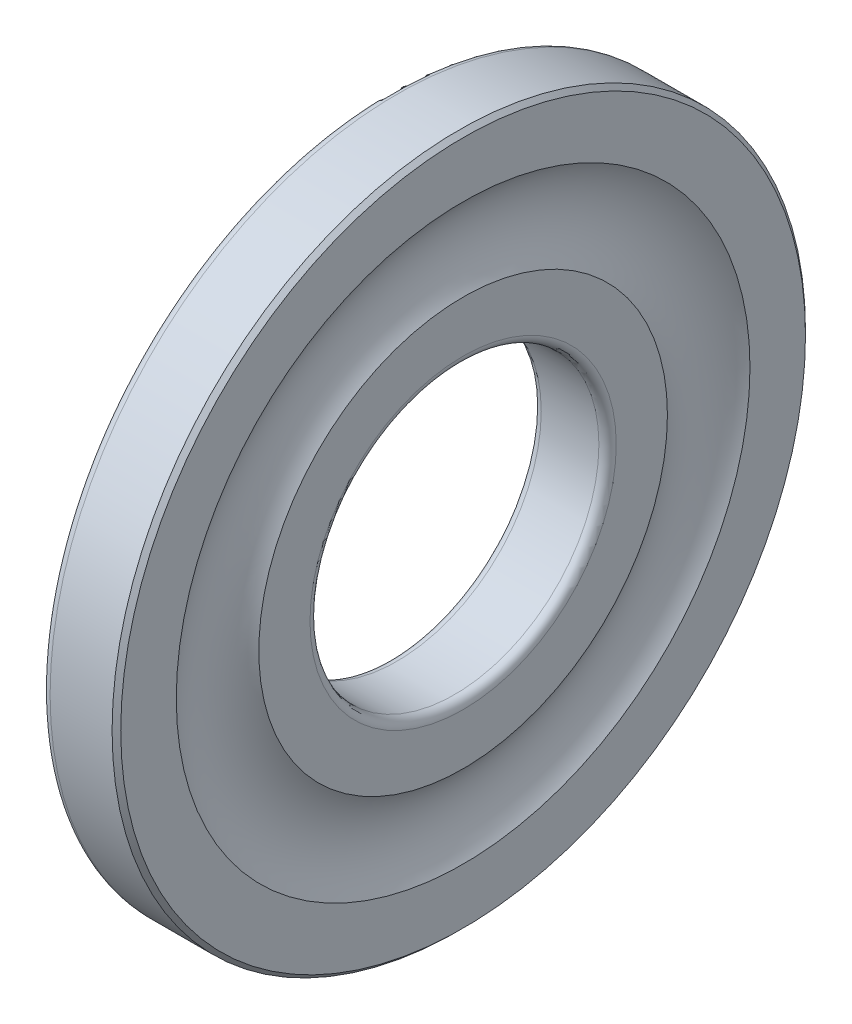
from build123d import *

# Parameters (mm, degrees)
CHAMFER_1_SIZE      = 0.15
CUT_EXTRUDE_1_DEPTH = 0.01


with BuildPart() as part:
    # Эскиз1 → Повернуть1 (revolve)
    with BuildSketch(Plane.XY, mode=Mode.PRIVATE) as revolve_1_sk:
        with BuildLine():
            Line((2.5952, 5.3), (2.5952, 7.0714))
            ThreePointArc((2.5952, 7.0714), (2.119, 8.5), (2.5952, 9.9286))
            Line((2.5952, 9.9286), (2.5952, 12))
            Line((2.5952, 12), (0.3, 12))
            ThreePointArc((0.3, 12), (0.087867966, 11.912132034), (0, 11.7))
            Line((0, 11.7), (0, 5.3))
            ThreePointArc((0, 5.3), (0.087867966, 5.087867966), (0.3, 5))
            Line((0.3, 5), (2.2952, 5))
            ThreePointArc((2.2952, 5), (2.507332034, 5.087867966), (2.5952, 5.3))
        make_face()
    revolve(revolve_1_sk.sketch.rotate(Axis((-0.001250003, 0, 0), (1, 0, 0)), 270), axis=Axis((-0.001250003, 0, 0), (1, 0, 0)))

    # Фаска1
    chamfer_1_edges = [part.edges().sort_by_distance(p)[0] for p in [
        (2.5952, 0, 12),
    ]]
    chamfer(chamfer_1_edges, length=CHAMFER_1_SIZE)

    # Эскиз2 → Вырез-Вытянуть1 (cut)
    # profile 1 of 5: a face of its own
    with BuildSketch(Plane.ZY):
        with BuildLine():
            Line((-3.449335757, 9.698230497), (-3.235874219, 9.78224492))
            add(Edge.make_bspline(
                [(-3.235874219, 9.78224492), (-3.229784564, 9.769899998), (-3.217947999, 9.745904967), (-3.197945585, 9.712169719), (-3.176818259, 9.681394817), (-3.153925474, 9.653956854), (-3.130212704, 9.629316466), (-3.105219723, 9.607763589), (-3.07871945, 9.589750729), (-3.051213621, 9.574509078), (-3.022855934, 9.562200995), (-2.9937566, 9.553314219), (-2.964495071, 9.546645666), (-2.934775992, 9.543065191), (-2.904706945, 9.54232803), (-2.874182548, 9.544603438), (-2.843241628, 9.549494129), (-2.822848423, 9.555124623), (-2.812556911, 9.557966074)],
                knots=[0, 0, 0, 0, 1.251147457, 2.431876173, 3.562593119, 4.641368937, 5.676936526, 6.669039123, 7.635965545, 8.584877578, 9.524748234, 10.440680684, 11.347440475, 12.250174455, 13.157460896, 14.077750772, 15.029929294, 16, 16, 16, 16], degree=3))
            add(Edge.make_bspline(
                [(-2.812556911, 9.557966074), (-2.800328284, 9.562057848), (-2.776262875, 9.570110282), (-2.742115967, 9.586101361), (-2.710665216, 9.605338147), (-2.681496713, 9.627399487), (-2.655084462, 9.652977753), (-2.630757878, 9.681401611), (-2.609563587, 9.713414591), (-2.59096418, 9.747960407), (-2.574846901, 9.78442881), (-2.563557595, 9.823031207), (-2.555299435, 9.862799408), (-2.552035869, 9.904053085), (-2.551931791, 9.946512303), (-2.555950461, 9.990340343), (-2.564357948, 10.035396113), (-2.572558752, 10.065470429), (-2.576739603, 10.080802612)],
                knots=[0, 0, 0, 0, 0.964056349, 1.8972211, 2.813161018, 3.717688707, 4.627029644, 5.558373415, 6.510957515, 7.492588551, 8.491363712, 9.486896088, 10.495497353, 11.524412324, 12.576364546, 13.668767218, 14.811514488, 16, 16, 16, 16], degree=3))
            add(Edge.make_bspline(
                [(-2.576739603, 10.080802612), (-2.581325243, 10.09518457), (-2.590313804, 10.123375422), (-2.607236459, 10.163350928), (-2.626752282, 10.200070326), (-2.648864893, 10.233284222), (-2.672920973, 10.263551198), (-2.700038176, 10.289982323), (-2.729131525, 10.31369327), (-2.761022358, 10.333225171), (-2.794054771, 10.35001214), (-2.828542498, 10.362712545), (-2.864020008, 10.371303463), (-2.900369542, 10.376349782), (-2.93772467, 10.378004484), (-2.976096574, 10.374727498), (-3.015467071, 10.368422984), (-3.041577301, 10.361333483), (-3.054864603, 10.357725689)],
                knots=[0, 0, 0, 0, 1.16139328, 2.276509754, 3.336018836, 4.357193876, 5.343973991, 6.305585848, 7.266351863, 8.22636044, 9.17790747, 10.114497127, 11.047883193, 11.982002477, 12.935570972, 13.918962916, 14.940975672, 16, 16, 16, 16], degree=3))
            add(Edge.make_bspline(
                [(-3.054864603, 10.357725689), (-3.071148653, 10.352399172), (-3.103242876, 10.341901142), (-3.14765354, 10.318735913), (-3.188243725, 10.291182545), (-3.22411817, 10.258776827), (-3.255079578, 10.222771602), (-3.280781584, 10.18419103), (-3.301993948, 10.143763942), (-3.311048164, 10.114982153), (-3.315561719, 10.100634343)],
                knots=[0, 0, 0, 0, 1.074591029, 2.117910793, 3.13352036, 4.149214105, 5.144959231, 6.108146363, 7.056905143, 8, 8, 8, 8], degree=3))
            Line((-3.315561719, 10.100634343), (-3.51928768, 10.067821843))
            Line((-3.51928768, 10.067821843), (-3.614840565, 10.990898766))
            Line((-3.614840565, 10.990898766), (-2.768927103, 11.242942036))
            Line((-2.768927103, 11.242942036), (-2.709431911, 11.043542997))
            Line((-2.709431911, 11.043542997), (-3.388398257, 10.841259343))
            Line((-3.388398257, 10.841259343), (-3.343686719, 10.356643959))
            add(Edge.make_bspline(
                [(-3.343686719, 10.356643959), (-3.333551588, 10.368965134), (-3.313529728, 10.393305504), (-3.280383896, 10.426203404), (-3.246728325, 10.456816943), (-3.210983525, 10.483619083), (-3.173979396, 10.507356238), (-3.135485273, 10.528140773), (-3.095538626, 10.545504232), (-3.067924786, 10.554458683), (-3.05414345, 10.558927612)],
                knots=[0, 0, 0, 0, 1.066534603, 2.10692949, 3.120478869, 4.107795162, 5.091339616, 6.058982001, 7.031289356, 8, 8, 8, 8], degree=3))
            add(Edge.make_bspline(
                [(-3.05414345, 10.558927612), (-3.035842725, 10.564012249), (-2.999723687, 10.574047489), (-2.944776913, 10.582024897), (-2.890579276, 10.585093968), (-2.837161753, 10.582580883), (-2.784493238, 10.574558686), (-2.732592799, 10.561214925), (-2.681585446, 10.541850592), (-2.631789008, 10.5173846), (-2.584020524, 10.488631048), (-2.54004337, 10.454696124), (-2.50011179, 10.416744387), (-2.463438571, 10.375121276), (-2.43198337, 10.328484827), (-2.403526369, 10.278290446), (-2.379790112, 10.223520913), (-2.367182044, 10.185117527), (-2.360754026, 10.165538189)],
                knots=[0, 0, 0, 0, 1.021464354, 2.016002635, 2.981327351, 3.939864647, 4.888659207, 5.844244694, 6.818739042, 7.819820684, 8.827257802, 9.814552537, 10.803033517, 11.78894957, 12.793849321, 13.824998917, 14.891111263, 16, 16, 16, 16], degree=3))
            add(Edge.make_bspline(
                [(-2.360754026, 10.165538189), (-2.355524039, 10.146500194), (-2.345183164, 10.108857745), (-2.335126865, 10.051911632), (-2.330191281, 9.995695659), (-2.329231994, 9.940225175), (-2.333491016, 9.885385296), (-2.343291891, 9.83135398), (-2.356464583, 9.777786204), (-2.369642974, 9.743305192), (-2.376258834, 9.72599492)],
                knots=[0, 0, 0, 0, 1.056062487, 2.088075833, 3.089019414, 4.073125904, 5.053758584, 6.02653515, 7.009274636, 8, 8, 8, 8], degree=3))
            add(Edge.make_bspline(
                [(-2.376258834, 9.72599492), (-2.385270404, 9.705319007), (-2.402955232, 9.664743396), (-2.43749097, 9.608700363), (-2.477229249, 9.557948428), (-2.522815104, 9.512358955), (-2.574138647, 9.472241083), (-2.631460633, 9.437944589), (-2.693956964, 9.408387549), (-2.738575533, 9.393786065), (-2.761354988, 9.386331459)],
                knots=[0, 0, 0, 0, 1.015547387, 1.99296908, 2.957514685, 3.915189676, 4.891604964, 5.885728805, 6.92058515, 8, 8, 8, 8], degree=3))
            add(Edge.make_bspline(
                [(-2.761354988, 9.386331459), (-2.780395919, 9.381110986), (-2.817701728, 9.370882813), (-2.873772849, 9.360790965), (-2.928426141, 9.355531729), (-2.981632566, 9.355747727), (-3.033341936, 9.359747835), (-3.0836029, 9.369277817), (-3.132348383, 9.383796764), (-3.179476955, 9.402803134), (-3.224240105, 9.426310872), (-3.266093077, 9.453631946), (-3.304713931, 9.484980957), (-3.340020132, 9.520164932), (-3.372799594, 9.558718883), (-3.401539365, 9.601783787), (-3.427743125, 9.648215946), (-3.442060705, 9.681379449), (-3.449335757, 9.698230497)],
                knots=[0, 0, 0, 0, 1.131349609, 2.21658865, 3.261444483, 4.274278115, 5.263014665, 6.230566486, 7.200690772, 8.174356339, 9.138984404, 10.094489493, 11.034971556, 11.98502077, 12.948368442, 13.930625985, 14.948509088, 16, 16, 16, 16], degree=3))
        make_face()
    # profile 2 of 5: a face of its own
    with BuildSketch(Plane.ZY):
        with BuildLine():
            Line((-1.164832905, 9.741052641), (-1.381900213, 9.710403603))
            Line((-1.381900213, 9.710403603), (-1.576251175, 11.093216103))
            add(Edge.make_bspline(
                [(-1.576251175, 11.093216103), (-1.588302501, 11.078606759), (-1.613502997, 11.048057197), (-1.657103031, 11.004186747), (-1.706213237, 10.958804044), (-1.760610839, 10.914518992), (-1.81620638, 10.871709596), (-1.870668386, 10.83325467), (-1.922103331, 10.799099329), (-1.95665246, 10.780022779), (-1.973246367, 10.770860334)],
                knots=[0, 0, 0, 0, 0.883568337, 1.847627425, 2.883938545, 4.003804904, 5.120293501, 6.158561745, 7.115559354, 8, 8, 8, 8], degree=3))
            Line((-1.973246367, 10.770860334), (-2.002813675, 10.980716103))
            add(Edge.make_bspline(
                [(-2.002813675, 10.980716103), (-1.975241175, 10.999430841), (-1.92078871, 11.036390261), (-1.845289762, 11.0978725), (-1.775853679, 11.162669237), (-1.713797029, 11.23043792), (-1.65985451, 11.299114631), (-1.614264938, 11.365924138), (-1.578922643, 11.431069839), (-1.562230721, 11.474994881), (-1.554255982, 11.495980526)],
                knots=[0, 0, 0, 0, 1.151343459, 2.273768753, 3.361223093, 4.431513305, 5.446255776, 6.377232222, 7.224705831, 8, 8, 8, 8], degree=3))
            Line((-1.554255982, 11.495980526), (-1.414352136, 11.515812257))
            Line((-1.414352136, 11.515812257), (-1.164832905, 9.741052641))
        make_face()
    # profile 3 of 5: a face of its own
    with BuildSketch(Plane.ZY):
        with BuildLine():
            Line((0.208016548, 9.809050723), (-0.022752683, 9.809050723))
            Line((-0.022752683, 9.809050723), (-0.022752683, 11.211694954))
            add(Edge.make_bspline(
                [(-0.022752683, 11.211694954), (-0.036040396, 11.19888059), (-0.06365745, 11.172247339), (-0.110341164, 11.134554637), (-0.162446154, 11.096351487), (-0.219295805, 11.059614886), (-0.277244407, 11.025031339), (-0.33324427, 10.993928755), (-0.386360452, 10.967608423), (-0.421348369, 10.953216361), (-0.438137298, 10.946310339)],
                knots=[0, 0, 0, 0, 0.893362401, 1.856755847, 2.901947673, 4.020460078, 5.132200827, 6.168787962, 7.121294059, 8, 8, 8, 8], degree=3))
            Line((-0.438137298, 10.946310339), (-0.438137298, 11.159050723))
            add(Edge.make_bspline(
                [(-0.438137298, 11.159050723), (-0.409300577, 11.173901693), (-0.352465106, 11.203172074), (-0.272168876, 11.253726046), (-0.197203708, 11.308528633), (-0.128810571, 11.367567701), (-0.067500483, 11.427916227), (-0.015833581, 11.488810261), (0.027397995, 11.548017689), (0.049088095, 11.589308304), (0.059458855, 11.609050723)],
                knots=[0, 0, 0, 0, 1.141258006, 2.249351951, 3.335817539, 4.406819942, 5.426913362, 6.360259544, 7.215985427, 8, 8, 8, 8], degree=3))
            Line((0.059458855, 11.609050723), (0.208016548, 11.609050723))
            Line((0.208016548, 11.609050723), (0.208016548, 9.809050723))
        make_face()
    # profile 4 of 5: a face of its own
    with BuildSketch(Plane.ZY):
        with BuildLine():
            add(Edge.make_bspline(
                [(0.905032196, 10.668695048), (0.908923495, 10.694209553), (0.916507784, 10.743938283), (0.930832512, 10.815996878), (0.945878824, 10.884101632), (0.962294292, 10.948015077), (0.980330168, 11.00797339), (1.000175117, 11.063592542), (1.020878856, 11.115368907), (1.043521632, 11.162917132), (1.067178453, 11.207152193), (1.09297843, 11.247928104), (1.119954141, 11.28604021), (1.14878552, 11.320847872), (1.178850094, 11.352946139), (1.21054585, 11.381782012), (1.24395232, 11.407584785), (1.278906162, 11.430277638), (1.315438683, 11.450032948), (1.353851411, 11.465706625), (1.393532518, 11.478640578), (1.434933684, 11.487020532), (1.477707118, 11.49260729), (1.522098494, 11.494251629), (1.568166879, 11.492550473), (1.599165789, 11.488535441), (1.615008158, 11.486483509)],
                knots=[0, 0, 0, 0, 1.518714251, 2.960031248, 4.322602995, 5.62302394, 6.842537229, 8.005884139, 9.097406561, 10.122555458, 11.103689037, 12.047657674, 12.960367497, 13.849727932, 14.705370322, 15.546594467, 16.368596516, 17.186724412, 17.996832308, 18.808636831, 19.625142519, 20.449181072, 21.290553894, 22.1612954, 23.060307724, 24, 24, 24, 24], degree=3))
            add(Edge.make_bspline(
                [(1.615008158, 11.486483509), (1.63796951, 11.482460251), (1.682591859, 11.474641582), (1.746076523, 11.454097071), (1.803988427, 11.427087104), (1.85650657, 11.393630963), (1.903308761, 11.353978034), (1.944786554, 11.308636211), (1.980202089, 11.257274093), (2.010173221, 11.200541774), (2.03508933, 11.138525973), (2.054659748, 11.071034968), (2.07010106, 10.998381707), (2.079198129, 10.934043877), (2.083320291, 10.878957857), (2.085311629, 10.833977438), (2.084603751, 10.785866456), (2.0829138, 10.734520047), (2.079270164, 10.679926555), (2.073677006, 10.622250659), (2.067036385, 10.561362418), (2.06093875, 10.519879183), (2.057796619, 10.49850274)],
                knots=[0, 0, 0, 0, 1.142810677, 2.220901265, 3.26311128, 4.270960222, 5.267039731, 6.264846442, 7.277601882, 8.319811896, 9.407379469, 10.551361456, 11.76368175, 13.049876337, 13.736099278, 14.473937569, 15.258392387, 16.09642597, 16.994858456, 17.942674778, 18.939853762, 20, 20, 20, 20], degree=3))
            add(Edge.make_bspline(
                [(2.057796619, 10.49850274), (2.053872837, 10.473234058), (2.046212279, 10.423900999), (2.032279327, 10.352185855), (2.017881811, 10.284339913), (2.0010675, 10.220673199), (1.983256363, 10.160943374), (1.963841989, 10.105320673), (1.942832864, 10.053838242), (1.920495124, 10.006156061), (1.896736307, 9.961841303), (1.870814824, 9.921037815), (1.844182797, 9.882762948), (1.815242511, 9.848027858), (1.785561659, 9.815679535), (1.753606406, 9.786879162), (1.720327573, 9.760719681), (1.685485443, 9.737550952), (1.648799772, 9.718133359), (1.610868174, 9.701523221), (1.570843825, 9.689532626), (1.529430511, 9.680250841), (1.486279073, 9.67550753), (1.441700328, 9.673616042), (1.395500124, 9.675365668), (1.364383463, 9.679387763), (1.348541812, 9.681435432)],
                knots=[0, 0, 0, 0, 1.505685682, 2.939610454, 4.301505911, 5.589037062, 6.816085844, 7.97112878, 9.056776047, 10.088965848, 11.070711014, 12.015268071, 12.934315452, 13.814267165, 14.675605481, 15.517354001, 16.344211643, 17.166726084, 17.977338958, 18.785878927, 19.600775488, 20.433729692, 21.281792637, 22.153076919, 23.059721969, 24, 24, 24, 24], degree=3))
            add(Edge.make_bspline(
                [(1.348541812, 9.681435432), (1.327896361, 9.684975365), (1.287448347, 9.691910705), (1.229606603, 9.709308611), (1.176122735, 9.732239234), (1.126816565, 9.760040351), (1.081593492, 9.793020845), (1.041179844, 9.831748534), (1.004094198, 9.874966358), (0.984056683, 9.907577529), (0.973902389, 9.924103702)],
                knots=[0, 0, 0, 0, 1.085561895, 2.126803748, 3.123703934, 4.097875998, 5.056610198, 6.017833544, 6.995509119, 8, 8, 8, 8], degree=3))
            add(Edge.make_bspline(
                [(0.973902389, 9.924103702), (0.962643793, 9.945730129), (0.939381569, 9.990414102), (0.914444247, 10.064688977), (0.895671044, 10.146323104), (0.884206324, 10.235806329), (0.878891045, 10.333050308), (0.880708368, 10.438187849), (0.888943806, 10.551123702), (0.899545604, 10.628599922), (0.905032196, 10.668695048)],
                knots=[0, 0, 0, 0, 0.768265157, 1.587369847, 2.463084724, 3.408058624, 4.429721093, 5.533329553, 6.723460404, 8, 8, 8, 8], degree=3))
        make_face()
        with BuildLine():
            add(Edge.make_bspline(
                [(1.128229312, 10.635882548), (1.123433636, 10.601055575), (1.114255668, 10.53440368), (1.104699695, 10.438440656), (1.099922067, 10.351089105), (1.099228019, 10.272245236), (1.103190926, 10.201944911), (1.112098639, 10.140156919), (1.12488915, 10.08687568), (1.142818363, 10.041705049), (1.16490988, 10.00378062), (1.188006085, 9.96998754), (1.213990319, 9.940882763), (1.241757174, 9.915722464), (1.271884324, 9.895078524), (1.304044776, 9.878558396), (1.338517486, 9.866463319), (1.362646131, 9.862120196), (1.374863927, 9.859921009)],
                knots=[0, 0, 0, 0, 1.859226416, 3.55818937, 5.098749296, 6.484542946, 7.72646087, 8.818737037, 9.782329993, 10.618071932, 11.378153083, 12.099417084, 12.779355371, 13.436598958, 14.076648583, 14.704942072, 15.344233644, 16, 16, 16, 16], degree=3))
            add(Edge.make_bspline(
                [(1.374863927, 9.859921009), (1.387108478, 9.858461973), (1.411325971, 9.855576266), (1.447700923, 9.857875701), (1.483414084, 9.86374067), (1.518174208, 9.875158557), (1.552020709, 9.891255393), (1.584988728, 9.912032318), (1.617089535, 9.937445347), (1.648850132, 9.9678313), (1.679395993, 10.00570527), (1.707208279, 10.053083059), (1.732813363, 10.109860882), (1.757443843, 10.175668612), (1.779242001, 10.251286748), (1.800256607, 10.336018429), (1.818845219, 10.430399557), (1.829189373, 10.496660091), (1.834599504, 10.53131524)],
                knots=[0, 0, 0, 0, 0.651723767, 1.288990917, 1.92204869, 2.564128818, 3.218953095, 3.902383027, 4.623059412, 5.383770005, 6.22569528, 7.190617145, 8.284164308, 9.520755972, 10.908279654, 12.448870752, 14.142711721, 16, 16, 16, 16], degree=3))
            add(Edge.make_bspline(
                [(1.834599504, 10.53131524), (1.839417778, 10.566140938), (1.848655391, 10.632908902), (1.857922621, 10.729015105), (1.863522379, 10.816573152), (1.863521581, 10.895442318), (1.859501727, 10.965695842), (1.851204534, 11.027310301), (1.83833757, 11.080523076), (1.819921421, 11.125400645), (1.798055922, 11.163385689), (1.774610078, 11.197035077), (1.748582021, 11.226165823), (1.720774955, 11.251618169), (1.690029769, 11.271835653), (1.657348323, 11.288118109), (1.622582305, 11.300846208), (1.598152502, 11.305117383), (1.585801427, 11.307276779)],
                knots=[0, 0, 0, 0, 1.855382666, 3.557146865, 5.094875181, 6.484132946, 7.717151735, 8.806264861, 9.76171518, 10.598114314, 11.35662408, 12.071206646, 12.758694815, 13.414579622, 14.055004841, 14.69332158, 15.339377295, 16, 16, 16, 16], degree=3))
            add(Edge.make_bspline(
                [(1.585801427, 11.307276779), (1.573558823, 11.308634471), (1.5495968, 11.311291835), (1.513864629, 11.310531311), (1.479427567, 11.305561414), (1.446401247, 11.296022914), (1.414619629, 11.28256077), (1.384238458, 11.26473051), (1.355096709, 11.24264201), (1.337640569, 11.22505054), (1.328710081, 11.216050817)],
                knots=[0, 0, 0, 0, 1.038428575, 2.032480134, 3.006306265, 3.966090695, 4.924856615, 5.911065947, 6.931310126, 8, 8, 8, 8], degree=3))
            add(Edge.make_bspline(
                [(1.328710081, 11.216050817), (1.317403559, 11.202741696), (1.293466416, 11.174564829), (1.263245991, 11.123851359), (1.235032107, 11.06459481), (1.208655233, 10.99639957), (1.185242648, 10.919037968), (1.163751706, 10.832726968), (1.144289072, 10.737440767), (1.133729591, 10.670665044), (1.128229312, 10.635882548)],
                knots=[0, 0, 0, 0, 0.673385593, 1.425630994, 2.2705097, 3.206542083, 4.245940136, 5.389627251, 6.640295056, 8, 8, 8, 8], degree=3))
        make_face(mode=Mode.SUBTRACT)
    # profile 5 of 5: a face of its own
    with BuildSketch(Plane.ZY):
        with BuildLine():
            add(Edge.make_bspline(
                [(2.386665109, 10.439180634), (2.394003021, 10.463854619), (2.408340118, 10.512063607), (2.431197804, 10.581929503), (2.455552041, 10.647360168), (2.480295971, 10.708629965), (2.505809406, 10.765754362), (2.532444437, 10.8185075), (2.560213914, 10.866840453), (2.588801999, 10.911181077), (2.618505018, 10.951684033), (2.649109737, 10.989091917), (2.68128131, 11.022811139), (2.71410222, 11.053873271), (2.748574226, 11.081156485), (2.783719952, 11.105938985), (2.820489458, 11.12675426), (2.857900491, 11.145036038), (2.896776445, 11.159505192), (2.936706554, 11.170428568), (2.977810563, 11.177025899), (3.019878176, 11.181061589), (3.063076553, 11.179840607), (3.107459854, 11.176061166), (3.152797994, 11.168091476), (3.182992287, 11.160076995), (3.198323763, 11.156007557)],
                knots=[0, 0, 0, 0, 1.514714759, 2.959508397, 4.324513766, 5.622095514, 6.847185632, 8.004826335, 9.097860769, 10.125805063, 11.10752936, 12.052015529, 12.967538733, 13.84822477, 14.70865716, 15.552269938, 16.375992801, 17.192120493, 18.000024639, 18.813235881, 19.623643628, 20.447093187, 21.295907663, 22.162249367, 23.066862463, 24, 24, 24, 24], degree=3))
            add(Edge.make_bspline(
                [(3.198323763, 11.156007557), (3.220495335, 11.148913493), (3.263678171, 11.13509662), (3.324064145, 11.106855014), (3.377963125, 11.072337958), (3.425450823, 11.032033771), (3.46694279, 10.986623595), (3.50209734, 10.936198044), (3.530871955, 10.88082925), (3.552709448, 10.820464347), (3.568630401, 10.755614776), (3.580065535, 10.686310846), (3.584941191, 10.612224778), (3.585409112, 10.547315587), (3.58258892, 10.492113356), (3.578216239, 10.447244036), (3.571590326, 10.39939589), (3.563007768, 10.348753738), (3.551901615, 10.295213867), (3.539522424, 10.238598425), (3.524225239, 10.179145906), (3.512827545, 10.138677338), (3.506977609, 10.117906596)],
                knots=[0, 0, 0, 0, 1.140952617, 2.222195619, 3.258955673, 4.271173047, 5.268500371, 6.267724999, 7.277587795, 8.320164127, 9.408231749, 10.548940664, 11.760678512, 13.045836082, 13.730588355, 14.470870702, 15.256232959, 16.099405178, 16.989632322, 17.937891606, 18.941610116, 20, 20, 20, 20], degree=3))
            add(Edge.make_bspline(
                [(3.506977609, 10.117906596), (3.499808015, 10.093337409), (3.485823699, 10.045415133), (3.462630104, 9.976057606), (3.438548307, 9.910891348), (3.41370031, 9.84989952), (3.388144224, 9.793034215), (3.361479858, 9.740498544), (3.334237206, 9.691926235), (3.30548129, 9.64785307), (3.27628553, 9.60706625), (3.245567173, 9.569952835), (3.213837806, 9.53592831), (3.180836736, 9.505074739), (3.146656774, 9.477304151), (3.111235535, 9.45268856), (3.074722179, 9.431307122), (3.037085793, 9.413259639), (2.998397408, 9.398188998), (2.958365838, 9.38742535), (2.917159161, 9.380705867), (2.874969742, 9.37691887), (2.831504081, 9.377358936), (2.787043891, 9.38188473), (2.7414536, 9.389717377), (2.711131456, 9.397721824), (2.695679532, 9.401800826)],
                knots=[0, 0, 0, 0, 1.506893516, 2.939200629, 4.305101913, 5.596980515, 6.816422864, 7.974823379, 9.065066474, 10.093685454, 11.071890042, 12.01699612, 12.928268983, 13.809533055, 14.674968867, 15.519135347, 16.346945917, 17.163609271, 17.974548926, 18.788293915, 19.599233569, 20.43027478, 21.279557915, 22.154175793, 23.059382627, 24, 24, 24, 24], degree=3))
            add(Edge.make_bspline(
                [(2.695679532, 9.401800826), (2.675694849, 9.408118317), (2.636564577, 9.420488047), (2.581665785, 9.445642075), (2.531375891, 9.474913459), (2.486002813, 9.508921176), (2.445646572, 9.547780594), (2.410470537, 9.591414603), (2.380251543, 9.639650392), (2.364405399, 9.674438958), (2.356376647, 9.692065249)],
                knots=[0, 0, 0, 0, 1.085758917, 2.125930278, 3.12302808, 4.09759681, 5.058301608, 6.019794209, 6.9966909, 8, 8, 8, 8], degree=3))
            add(Edge.make_bspline(
                [(2.356376647, 9.692065249), (2.347945598, 9.714959749), (2.330558068, 9.762175557), (2.315794483, 9.83920846), (2.308458637, 9.922658013), (2.308763395, 10.013013762), (2.316586467, 10.109999771), (2.332044626, 10.213903417), (2.355111263, 10.324686667), (2.375896401, 10.400106092), (2.386665109, 10.439180634)],
                knots=[0, 0, 0, 0, 0.768684527, 1.585274234, 2.464872902, 3.409117917, 4.432309616, 5.532248464, 6.721466523, 8, 8, 8, 8], degree=3))
        make_face()
        with BuildLine():
            add(Edge.make_bspline(
                [(2.603732417, 10.376800826), (2.594375892, 10.342965253), (2.576463802, 10.278190576), (2.554288809, 10.18443057), (2.537963264, 10.098518888), (2.526790676, 10.020579533), (2.521388516, 9.950449131), (2.521927524, 9.888187077), (2.52743819, 9.83362613), (2.539462669, 9.786493253), (2.556481654, 9.745908809), (2.574831657, 9.709232289), (2.596697282, 9.676899049), (2.621082103, 9.648551581), (2.647725701, 9.623595485), (2.677860575, 9.603428316), (2.7102492, 9.586416557), (2.733643679, 9.578985205), (2.745439147, 9.575238326)],
                knots=[0, 0, 0, 0, 1.857111126, 3.555245638, 5.095412302, 6.482059683, 7.718841315, 8.812599161, 9.772499203, 10.613017389, 11.374620641, 12.096961831, 12.77947096, 13.433297421, 14.072331564, 14.703727575, 15.346420944, 16, 16, 16, 16], degree=3))
            add(Edge.make_bspline(
                [(2.745439147, 9.575238326), (2.757398646, 9.572277566), (2.781085533, 9.566413509), (2.817517183, 9.563218332), (2.853758696, 9.565104071), (2.889760953, 9.571638584), (2.925411031, 9.583086711), (2.960982983, 9.598951124), (2.995966896, 9.620358331), (3.03170059, 9.646023329), (3.067001597, 9.67952926), (3.100738217, 9.722752155), (3.133649645, 9.775623758), (3.166784474, 9.837548653), (3.198658, 9.909550786), (3.230191893, 9.990920163), (3.261169456, 10.082039532), (3.280280504, 10.146321944), (3.290270878, 10.179925826)],
                knots=[0, 0, 0, 0, 0.651540251, 1.290435343, 1.927553431, 2.56784128, 3.221893607, 3.905459915, 4.624617724, 5.389530066, 6.231234355, 7.191218087, 8.283935256, 9.525140669, 10.906489696, 12.4497538, 14.144094963, 16, 16, 16, 16], degree=3))
            add(Edge.make_bspline(
                [(3.290270878, 10.179925826), (3.299630404, 10.213881155), (3.317551135, 10.278895598), (3.339666944, 10.37290809), (3.35608001, 10.459041657), (3.367202346, 10.53711472), (3.372563365, 10.6073524), (3.372247884, 10.669535264), (3.366063879, 10.723912971), (3.354189908, 10.770949309), (3.337253022, 10.811467231), (3.318715213, 10.847931191), (3.296828028, 10.880294469), (3.272443593, 10.908936887), (3.244914676, 10.933389889), (3.214932581, 10.954191856), (3.181661124, 10.970571629), (3.158046658, 10.978286784), (3.146040109, 10.98220948)],
                knots=[0, 0, 0, 0, 1.858305196, 3.558106513, 5.094184611, 6.483432688, 7.716931129, 8.807785457, 9.759575931, 10.597862857, 11.357444337, 12.072235536, 12.752932859, 13.413966892, 14.051746206, 14.69028178, 15.334086302, 16, 16, 16, 16], degree=3))
            add(Edge.make_bspline(
                [(3.146040109, 10.98220948), (3.134079002, 10.985249894), (3.110738366, 10.991182889), (3.075222423, 10.995296298), (3.040490544, 10.994322475), (3.006330772, 10.989984008), (2.973202462, 10.980073195), (2.94053354, 10.966967943), (2.908872377, 10.948535419), (2.889040969, 10.933621491), (2.878852609, 10.92595948)],
                knots=[0, 0, 0, 0, 1.039806484, 2.029055004, 3.002080946, 3.963695033, 4.922742816, 5.908820243, 6.925659089, 8, 8, 8, 8], degree=3))
            add(Edge.make_bspline(
                [(2.878852609, 10.92595948), (2.865912502, 10.914250969), (2.838448944, 10.8894013), (2.801668399, 10.84323028), (2.76610075, 10.787901652), (2.731309605, 10.723587977), (2.697462694, 10.650086258), (2.664956146, 10.567238703), (2.632708512, 10.475452577), (2.613645561, 10.410551028), (2.603732417, 10.376800826)],
                knots=[0, 0, 0, 0, 0.672587767, 1.427473037, 2.268891252, 3.209187896, 4.246862789, 5.389883227, 6.642683107, 8, 8, 8, 8], degree=3))
        make_face(mode=Mode.SUBTRACT)
    extrude(amount=-CUT_EXTRUDE_1_DEPTH, mode=Mode.SUBTRACT)


solid = part.part
